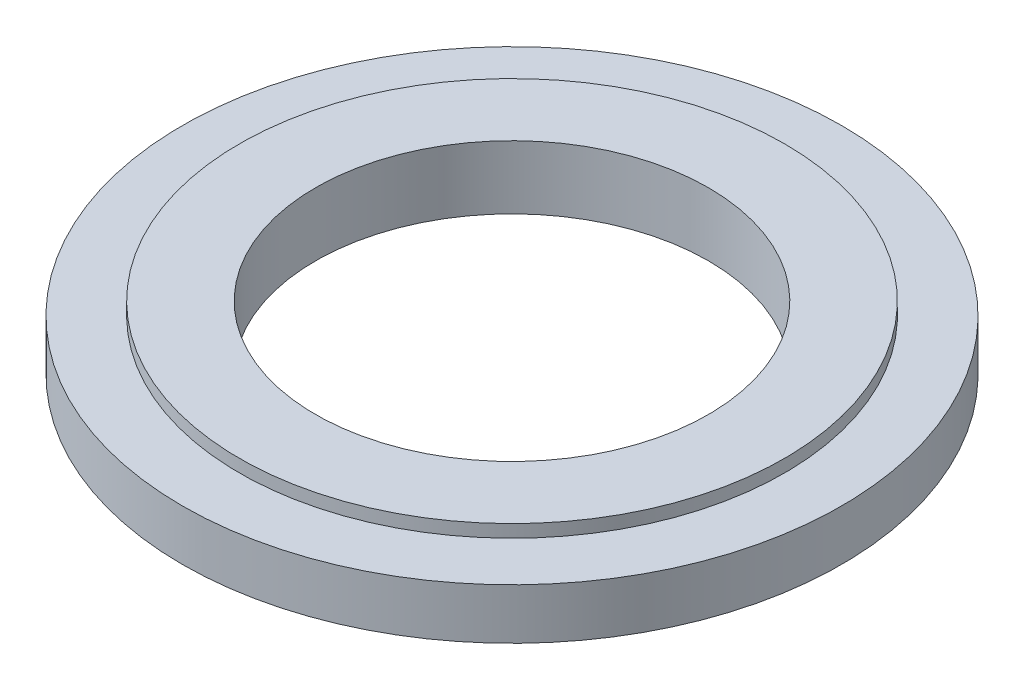
from build123d import *


with BuildPart() as part:
    # Sketch1 → Revolve1 (revolve)
    with BuildSketch(Plane.XY, mode=Mode.PRIVATE) as revolve1_sk:
        Polygon((-7.75, 0), (-13, 0), (-13, 2), (-10.75, 2), (-10.75, 2.5), (-7.75, 2.5), align=None)
    revolve(revolve1_sk.sketch.rotate(Axis((0, 0, 0), (0, 1, 0)), 270), axis=Axis((0, 0, 0), (0, 1, 0)))


solid = part.part
